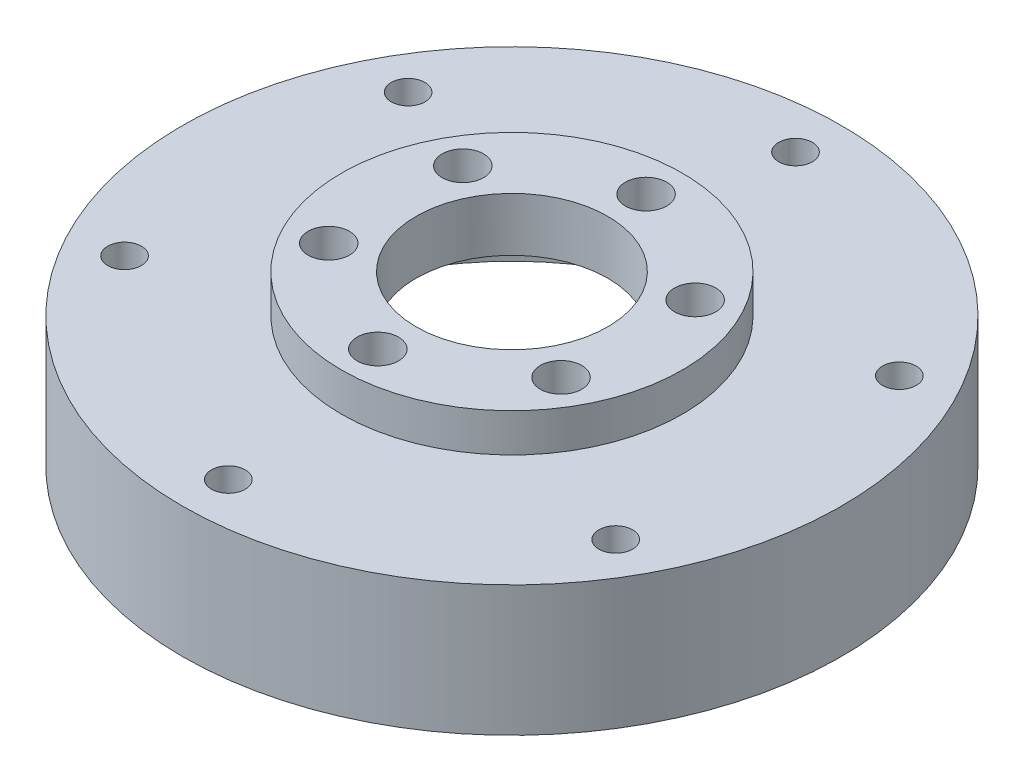
from build123d import *

# Parameters (mm, degrees)
SKETCH_22_R              = 43
EXTRUDE_5_DEPTH          = 17
SKETCH_24_R              = 22.244
EXTRUDE_6_DEPTH          = 5
SKETCH_25_R              = 32.76
CUT_EXTRUDE_9_DEPTH      = 15
SKETCH_26_R              = 12.5
CUT_EXTRUDE_10_DEPTH     = 10
SKETCH_27_R              = 2.7
CUT_EXTRUDE_11_DEPTH     = 6.1
PATTERN_CIRCULAR_6_COUNT = 6
SKETCH_29_R              = 2.2
CUT_EXTRUDE_12_DEPTH     = 64.14269554
PATTERN_CIRCULAR_7_COUNT = 6


with BuildPart() as part:
    # 스케치22 → 보스-돌출5 (new body)
    with BuildSketch(Plane(origin=(0, 0, 0), x_dir=(1, 0, 0), z_dir=(0, 1, 0))):
        with Locations(Location((0, 0, 0), (0, 0, 270))):
            Circle(SKETCH_22_R)
    extrude(amount=EXTRUDE_5_DEPTH)

    # 스케치24 → 보스-돌출6 (add)
    with BuildSketch(Plane(origin=(0, 17, 0), x_dir=(1, 0, 0), z_dir=(0, 1, 0))):
        with Locations(Location((0, 0, 0), (0, 0, 270))):
            Circle(SKETCH_24_R)
    extrude(amount=EXTRUDE_6_DEPTH)

    # 스케치25 → 컷-돌출9 (cut)
    with BuildSketch(Plane.XZ):
        with Locations(Location((0, 0, 0), (0, 0, 270))):
            Circle(SKETCH_25_R)
    extrude(amount=-CUT_EXTRUDE_9_DEPTH, mode=Mode.SUBTRACT)

    # 스케치26 → 컷-돌출10 (cut)
    with BuildSketch(Plane(origin=(0, 22, 0), x_dir=(1, 0, 0), z_dir=(0, 1, 0))):
        with Locations(Location((0, 0, 0), (0, 0, 270))):
            Circle(SKETCH_26_R)
    extrude(amount=-CUT_EXTRUDE_10_DEPTH, mode=Mode.SUBTRACT)

    # 스케치27 → 컷-돌출11 (cut)
    with BuildSketch(Plane(origin=(0, 22, 0), x_dir=(1, 0, 0), z_dir=(0, 1, 0))):
        with Locations(Location((0, 17.5, 0), (0, 0, 270))):
            Circle(SKETCH_27_R)
    cut_extrude_11 = extrude(amount=-CUT_EXTRUDE_11_DEPTH, mode=Mode.SUBTRACT)

    # 원형 패턴6: 컷-돌출11 ×6 about axis
    pattern_circular_6_axis = Axis((0, 0, 0), (0, 1, 0))
    for i in range(1, PATTERN_CIRCULAR_6_COUNT):
        add(cut_extrude_11.rotate(pattern_circular_6_axis, i * 360 / PATTERN_CIRCULAR_6_COUNT), mode=Mode.SUBTRACT)

    # 스케치29 → 컷-돌출12 (cut, through all)
    with BuildSketch(Plane(origin=(0, 17, 0), x_dir=(1, 0, 0), z_dir=(0, 1, 0))):
        with Locations(Location((0, 37, 0), (0, 0, 270))):
            Circle(SKETCH_29_R)
    cut_extrude_12 = extrude(amount=-CUT_EXTRUDE_12_DEPTH, mode=Mode.SUBTRACT)

    # 원형 패턴7: 컷-돌출12 ×6 about axis
    pattern_circular_7_axis = Axis((0, 0, 0), (0, 1, 0))
    for i in range(1, PATTERN_CIRCULAR_7_COUNT):
        add(cut_extrude_12.rotate(pattern_circular_7_axis, i * 360 / PATTERN_CIRCULAR_7_COUNT), mode=Mode.SUBTRACT)


solid = part.part
